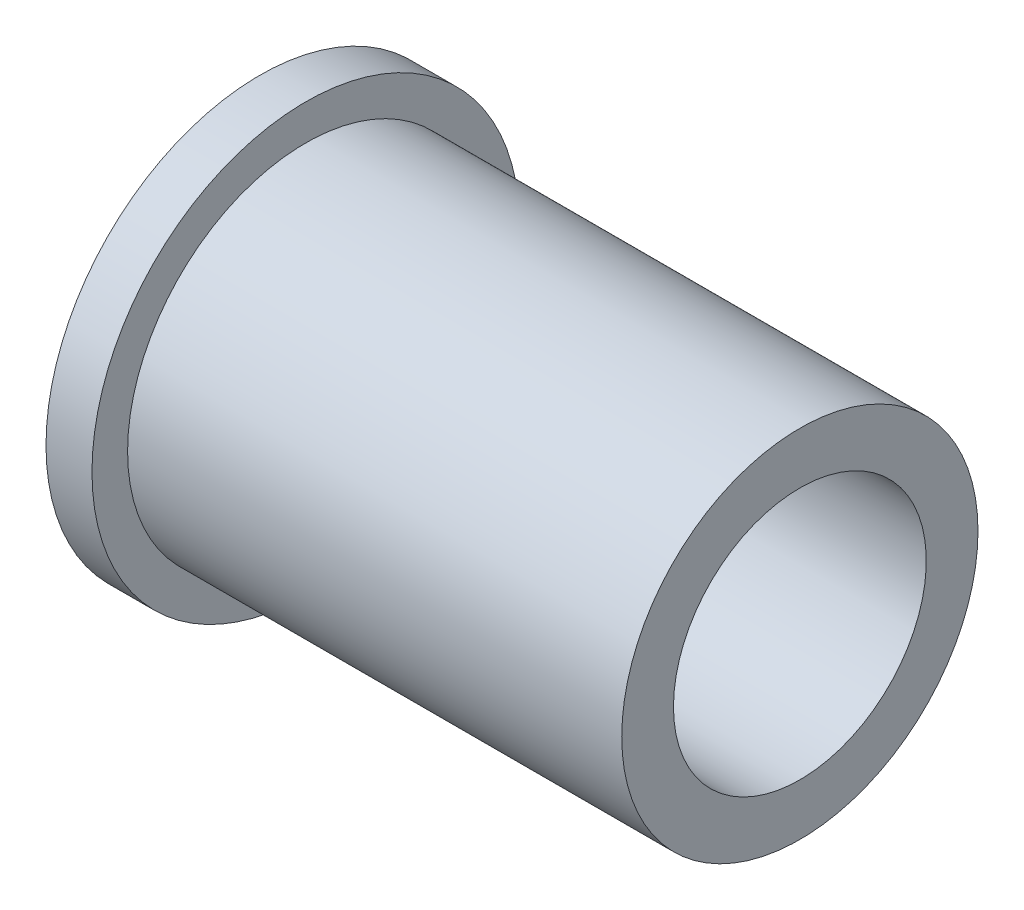
from build123d import *


with BuildPart() as part:
    # Esquisse1 → Révolution1 (revolve)
    with BuildSketch(Plane.XY, mode=Mode.PRIVATE) as r_volution1_sk:
        Polygon((0, 18.6), (0, 11), (47, 11), (47, 15.5), (4, 15.5), (4, 18.6), align=None)
    revolve(r_volution1_sk.sketch.rotate(Axis((0, 0, 0), (1, 0, 0)), 90), axis=Axis((0, 0, 0), (1, 0, 0)))


solid = part.part
